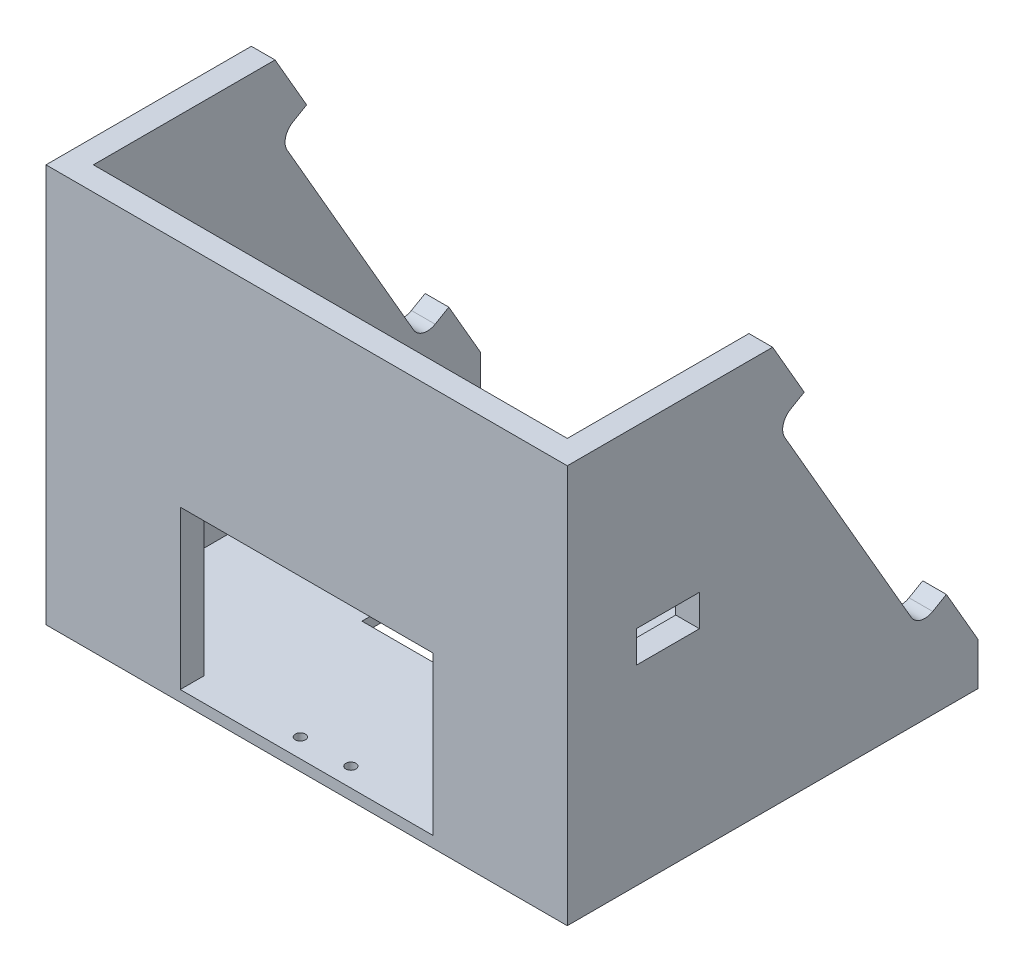
from build123d import *

# Parameters (mm, degrees)
BOSS_EXTRUDE1_DEPTH = 82.5
SKETCH4_W           = 165
SKETCH4_H           = 90
CUT_EXTRUDE1_DEPTH  = 10
SKETCH6_W           = 150
SKETCH6_H           = 122.5
CUT_EXTRUDE2_DEPTH  = 154.968340902
SKETCH7_W           = 80
SKETCH7_H           = 40
CUT_EXTRUDE3_DEPTH  = 60
SKETCH8_W           = 150
SKETCH8_H           = 2
BOSS_EXTRUDE2_DEPTH = 57.5
SKETCH9_W           = 20
SKETCH9_H           = 10
CUT_EXTRUDE4_DEPTH  = 211.059515376
SKETCH10_R          = 2
CUT_EXTRUDE5_DEPTH  = 6
CHAMFER1_SIZE       = 5
FILLET1_R           = 5
BOSS_EXTRUDE3_DEPTH = 10
SKETCH17_W          = 165
SKETCH17_H          = 130
BOSS_EXTRUDE4_DEPTH = 3.5
SKETCH16_R          = 2
CUT_EXTRUDE6_DEPTH  = 4
SKETCH19_R          = 1.6
SKETCH19_W          = 60
SKETCH19_H          = 35
CUT_EXTRUDE7_DEPTH  = 10


with BuildPart() as part:
    # Sketch2 → Boss-Extrude1 (new, symmetric)
    with BuildSketch(Plane(origin=(0, 0, 0), x_dir=(0, 0, -1), z_dir=(1, 0, 0))):
        Polygon((0, 112.583302492), (65, 0), (0, 0), (-65, 0), (-65, 112.583302492), align=None)
    extrude(amount=BOSS_EXTRUDE1_DEPTH, both=True)

    # Sketch4 → Cut-Extrude1 (cut)
    with BuildSketch(Plane(origin=(0, 28.145825623, -48.75), x_dir=(-1, 0, 0), z_dir=(0, 0.5000000000000044, -0.8660254037844362))):
        with Locations((0, 32.5)):
            Rectangle(SKETCH4_W, SKETCH4_H)
    extrude(amount=-CUT_EXTRUDE1_DEPTH, mode=Mode.SUBTRACT)

    # Sketch6 → Cut-Extrude2 (cut, through all)
    with BuildSketch(Plane(origin=(0, 112.583302492, 0), x_dir=(1, 0, 0), z_dir=(0, 1, 0))):
        with Locations((0, 3.75)):
            Rectangle(SKETCH6_W, SKETCH6_H)
    extrude(amount=-CUT_EXTRUDE2_DEPTH, mode=Mode.SUBTRACT)

    # Sketch7 → Cut-Extrude3 (cut)
    with BuildSketch(Plane.XY.offset(65)):
        with Locations((0, 20)):
            Rectangle(SKETCH7_W, SKETCH7_H)
    extrude(amount=-CUT_EXTRUDE3_DEPTH, mode=Mode.SUBTRACT)

    # Sketch8 → Boss-Extrude2 (add)
    with BuildSketch(Plane(origin=(0, 0, 57.5), x_dir=(-1, 0, 0), z_dir=(0, 0, -1))):
        with Locations((0, 41)):
            Rectangle(SKETCH8_W, SKETCH8_H)
    extrude(amount=BOSS_EXTRUDE2_DEPTH)

    # Sketch9 → Cut-Extrude4 (cut, through all)
    with BuildSketch(Plane.ZY.offset(82.5)):
        with Locations((33.170135622, 52)):
            Rectangle(SKETCH9_W, SKETCH9_H)
    extrude(amount=-CUT_EXTRUDE4_DEPTH, mode=Mode.SUBTRACT)

    # Sketch10 → Cut-Extrude5 (cut)
    with BuildSketch(Plane(origin=(0, 28.145825623, -48.75), x_dir=(-1, 0, 0), z_dir=(0, 0.5000000000000038, -0.8660254037844366))):
        with Locations(Location((-78.5, 89.25545404, 0), (0, 0, 90))):
            Circle(SKETCH10_R)
        with Locations(Location((78.5, 89.25545404, 0), (0, 0, 90))):
            Circle(SKETCH10_R)
        with Locations(Location((78.5, -25.24454596, 0), (0, 0, 90))):
            Circle(SKETCH10_R)
        with Locations(Location((-78.5, -25.74454596, 0), (0, 0, 90))):
            Circle(SKETCH10_R)
    extrude(amount=-CUT_EXTRUDE5_DEPTH, mode=Mode.SUBTRACT)

    # Chamfer1
    chamfer1_edges = [part.edges().sort_by_distance(p)[0] for p in [
        (57.5, 40, 57.5),
        (-57.5, 40, 57.5),
        (75, 40, 28.75),
        (-75, 40, 28.75),
    ]]
    chamfer(chamfer1_edges, length=CHAMFER1_SIZE)

    # Fillet1
    fillet1_edges = [part.edges().sort_by_distance(p)[0] for p in [
        (-78.75, 90.262794416, -1.339745962),
        (78.75, 12.320508076, -46.339745962),
        (-78.75, 12.320508076, -46.339745962),
        (78.75, 90.262794416, -1.339745962),
    ]]
    fillet(fillet1_edges, radius=FILLET1_R)

    # Sketch12 → Boss-Extrude3 (add)
    with BuildSketch(Plane.XZ):
        Polygon((82.5, 65), (40, 65), (40, 57.5), (75, 57.5), (75, -65), (82.5, -65), align=None)
        Polygon((-75, 57.5), (-40, 57.5), (-40, 65), (-82.5, 65), (-82.5, -65), (-75, -65), align=None)
    extrude(amount=BOSS_EXTRUDE3_DEPTH)

    # Sketch17 → Boss-Extrude4 (add)
    with BuildSketch(Plane.XZ.offset(10)):
        Rectangle(SKETCH17_W, SKETCH17_H)
    extrude(amount=BOSS_EXTRUDE4_DEPTH)

    # Sketch16 → Cut-Extrude6 (cut)
    with BuildSketch(Plane.XZ.offset(13.5)):
        with Locations(Location((-65, 60, 0), (0, 0, 270))):
            Circle(SKETCH16_R)
        with Locations(Location((65, 60, 0), (0, 0, 270))):
            Circle(SKETCH16_R)
        with Locations(Location((65, -60, 0), (0, 0, 270))):
            Circle(SKETCH16_R)
        with Locations(Location((-65, -60, 0), (0, 0, 270))):
            Circle(SKETCH16_R)
    extrude(amount=-CUT_EXTRUDE6_DEPTH, mode=Mode.SUBTRACT)

    # Sketch19 → Cut-Extrude7 (cut)
    with BuildSketch(Plane.XZ.offset(13.5)):
        with Locations(Location((-8, 59, 0), (0, 0, 270))):
            Circle(SKETCH19_R)
        with Locations(Location((8, 59, 0), (0, 0, 270))):
            Circle(SKETCH19_R)
        Rectangle(SKETCH19_W, SKETCH19_H)
    extrude(amount=-CUT_EXTRUDE7_DEPTH, mode=Mode.SUBTRACT)


solid = part.part
